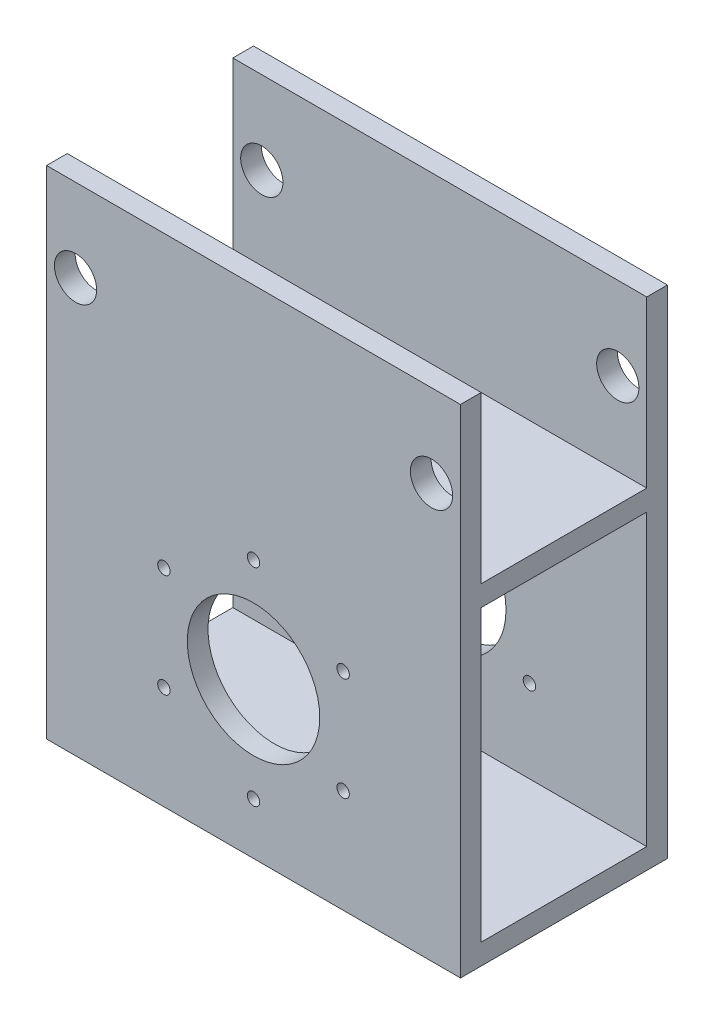
from build123d import *

# Parameters (mm, degrees)
SKETCH1_W                = 100
SKETCH1_H                = 120
BOSS_EXTRUDE1_DEPTH      = 5
SKETCH2_W                = 100
SKETCH2_H                = 5
BOSS_EXTRUDE2_DEPTH      = 45
BOSS_EXTRUDE3_DEPTH      = 40
BOSS_EXTRUDE3_DEPTH_BACK = 60
SKETCH3_W                = 100
SKETCH3_H                = 5
SKETCH6_W                = 100
SKETCH6_H                = 5
BOSS_EXTRUDE4_DEPTH      = 15
SKETCH7_W                = 100
SKETCH7_H                = 5
BOSS_EXTRUDE5_DEPTH      = 45
SKETCH8_R                = 16
SKETCH8_R_2              = 1.5
CUT_EXTRUDE1_DEPTH       = 93.736184955
SKETCH10_R               = 5.1
CUT_EXTRUDE2_DEPTH       = 93.736184955


with BuildPart() as part:
    # Sketch1 → Boss-Extrude1 (new body)
    with BuildSketch(Plane.XY):
        Rectangle(SKETCH1_W, SKETCH1_H)
    extrude(amount=BOSS_EXTRUDE1_DEPTH)

    # Sketch2 → Boss-Extrude2 (add)
    with BuildSketch(Plane.XY.offset(5)):
        with Locations((0, 17.5)):
            Rectangle(SKETCH2_W, SKETCH2_H)
    extrude(amount=BOSS_EXTRUDE2_DEPTH)

    # Sketch3 → Boss-Extrude3 (add, two sides: drawn at the far end of the back side and taken through both)
    with BuildSketch(Plane(origin=(0, 20, 0), x_dir=(1, 0, 0), z_dir=(0, 1, 0)).offset(-BOSS_EXTRUDE3_DEPTH_BACK)):
        with Locations((0, -47.5)):
            Rectangle(SKETCH3_W, SKETCH3_H)
    extrude(amount=BOSS_EXTRUDE3_DEPTH + BOSS_EXTRUDE3_DEPTH_BACK)

    # Sketch6 → Boss-Extrude4 (add)
    with BuildSketch(Plane.XZ.offset(40)):
        with Locations((0, 47.5)):
            Rectangle(SKETCH6_W, SKETCH6_H)
        with Locations((0, 2.5)):
            Rectangle(SKETCH6_W, SKETCH6_H)
    extrude(amount=BOSS_EXTRUDE4_DEPTH)

    # Sketch7 → Boss-Extrude5 (add)
    with BuildSketch(Plane.XY.offset(5)):
        with Locations((0, -57.5)):
            Rectangle(SKETCH7_W, SKETCH7_H)
    extrude(amount=BOSS_EXTRUDE5_DEPTH)

    # Sketch8 → Cut-Extrude1 (cut, through all)
    with BuildSketch(Plane.XY.offset(50)):
        with Locations((0, -22.5)):
            Circle(SKETCH8_R)
        with Locations((0, 2.5)):
            Circle(SKETCH8_R_2)
        with Locations((21.650635095, -10)):
            Circle(SKETCH8_R_2)
        with Locations((21.650635095, -35)):
            Circle(SKETCH8_R_2)
        with Locations((0, -47.5)):
            Circle(SKETCH8_R_2)
        with Locations((-21.650635095, -35)):
            Circle(SKETCH8_R_2)
        with Locations((-21.650635095, -10)):
            Circle(SKETCH8_R_2)
    extrude(amount=-CUT_EXTRUDE1_DEPTH, mode=Mode.SUBTRACT)

    # Sketch10 → Cut-Extrude2 (cut, through all)
    with BuildSketch(Plane.XY.offset(50)):
        with Locations((-43, 40)):
            Circle(SKETCH10_R)
        with Locations((43, 40)):
            Circle(SKETCH10_R)
    extrude(amount=-CUT_EXTRUDE2_DEPTH, mode=Mode.SUBTRACT)


solid = part.part
